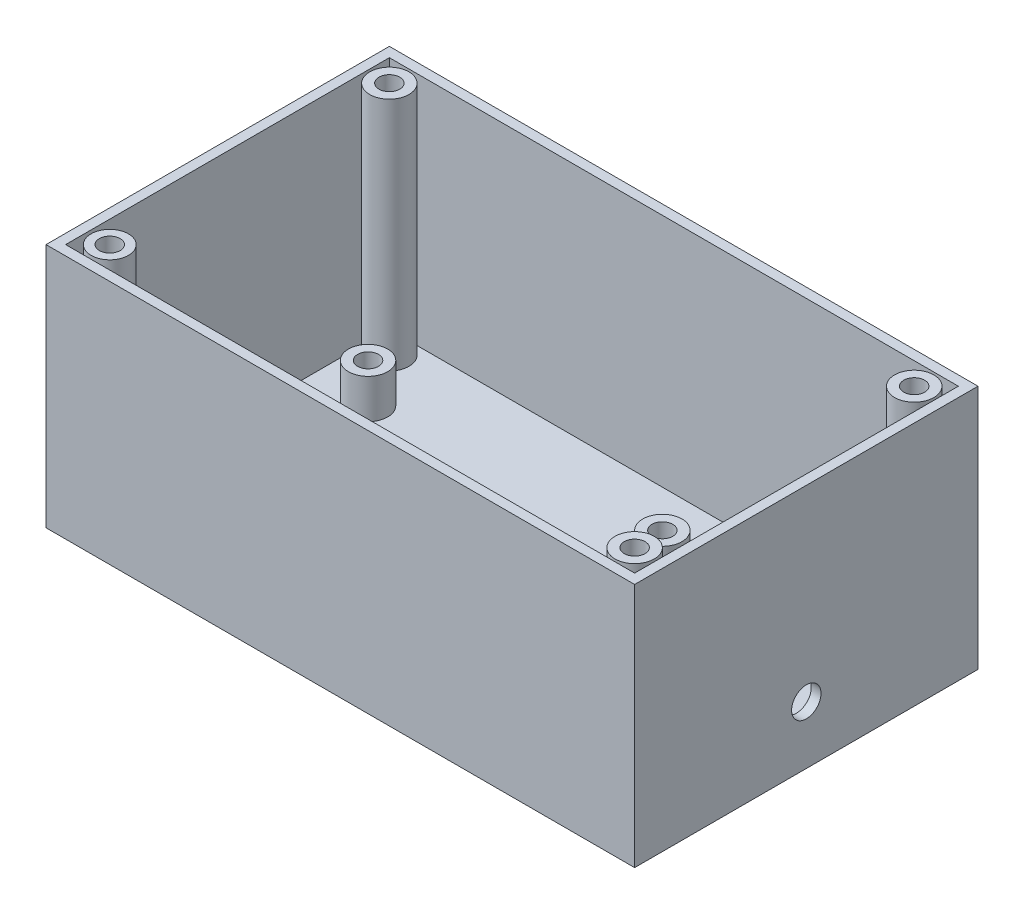
from build123d import *

# Parameters (mm, degrees)
SKETCH1_W           = 120
SKETCH1_H           = 70
BOSS_EXTRUDE1_DEPTH = 50
SKETCH4_W           = 116
SKETCH4_H           = 66
CUT_EXTRUDE1_DEPTH  = 48
SKETCH5_R           = 4
SKETCH5_R_2         = 2.125
SKETCH5_R_3         = 3.805710372
BOSS_EXTRUDE2_DEPTH = 48
SKETCH7_R           = 4
SKETCH7_R_2         = 2.125
BOSS_EXTRUDE3_DEPTH = 8
SKETCH9_R           = 3
CUT_EXTRUDE2_DEPTH  = 3
CUT_EXTRUDE3_START  = -3
SKETCH10_R          = 3
CUT_EXTRUDE3_DEPTH  = 3


with BuildPart() as part:
    # Sketch1 → Boss-Extrude1 (new body)
    with BuildSketch(Plane(origin=(0, 0, 0), x_dir=(1, 0, 0), z_dir=(0, 1, 0))):
        Rectangle(SKETCH1_W, SKETCH1_H)
    extrude(amount=BOSS_EXTRUDE1_DEPTH)

    # Sketch4 → Cut-Extrude1 (cut)
    with BuildSketch(Plane(origin=(0, 50, 0), x_dir=(1, 0, 0), z_dir=(0, 1, 0))):
        Rectangle(SKETCH4_W, SKETCH4_H)
    extrude(amount=-CUT_EXTRUDE1_DEPTH, mode=Mode.SUBTRACT)

    # Sketch5 → Boss-Extrude2 (add)
    # profile 1 of 4: a face of its own
    with BuildSketch(Plane(origin=(0, 2, 0), x_dir=(1, 0, 0), z_dir=(0, 1, 0))):
        with Locations(Location((-53.5, 28.5, 0), (0, 0, 270))):
            Circle(SKETCH5_R)
        with Locations(Location((-53.5, 28.5, 0), (0, 0, 270))):
            Circle(SKETCH5_R_2, mode=Mode.SUBTRACT)
    # profile 2 of 4: a face of its own
    with BuildSketch(Plane(origin=(0, 2, 0), x_dir=(1, 0, 0), z_dir=(0, 1, 0))):
        with Locations(Location((-53.5, -28.5, 0), (0, 0, 270))):
            Circle(SKETCH5_R_3)
        with Locations(Location((-53.5, -28.5, 0), (0, 0, 270))):
            Circle(SKETCH5_R_2, mode=Mode.SUBTRACT)
    # profile 3 of 4: a face of its own
    with BuildSketch(Plane(origin=(0, 2, 0), x_dir=(1, 0, 0), z_dir=(0, 1, 0))):
        with Locations(Location((53.5, -28.5, 0), (0, 0, 270))):
            Circle(SKETCH5_R)
        with Locations(Location((53.5, -28.5, 0), (0, 0, 270))):
            Circle(SKETCH5_R_2, mode=Mode.SUBTRACT)
    # profile 4 of 4: a face of its own
    with BuildSketch(Plane(origin=(0, 2, 0), x_dir=(1, 0, 0), z_dir=(0, 1, 0))):
        with Locations(Location((53.5, 28.5, 0), (0, 0, 270))):
            Circle(SKETCH5_R)
        with Locations(Location((53.5, 28.5, 0), (0, 0, 270))):
            Circle(SKETCH5_R_2, mode=Mode.SUBTRACT)
    extrude(amount=BOSS_EXTRUDE2_DEPTH)

    # Sketch7 → Boss-Extrude3 (add)
    # profile 1 of 8: a face of its own
    with BuildSketch(Plane(origin=(0, 2, 0), x_dir=(1, 0, 0), z_dir=(0, 1, 0))):
        with Locations(Location((41.989163704, 23.984280939, 0), (0, 0, 270))):
            Circle(SKETCH7_R)
        with Locations(Location((41.989163704, 23.984280939, 0), (0, 0, 270))):
            Circle(SKETCH7_R_2, mode=Mode.SUBTRACT)
    # profile 2 of 8: a face of its own
    with BuildSketch(Plane(origin=(0, 2, 0), x_dir=(1, 0, 0), z_dir=(0, 1, 0))):
        with Locations(Location((27.989163704, 23.984280939, 0), (0, 0, 270))):
            Circle(SKETCH7_R)
        with Locations(Location((27.989163704, 23.984280939, 0), (0, 0, 270))):
            Circle(SKETCH7_R_2, mode=Mode.SUBTRACT)
    # profile 3 of 8: a face of its own
    with BuildSketch(Plane(origin=(0, 2, 0), x_dir=(1, 0, 0), z_dir=(0, 1, 0))):
        with Locations(Location((27.989163704, -25.015719061, 0), (0, 0, 270))):
            Circle(SKETCH7_R)
        with Locations(Location((27.989163704, -25.015719061, 0), (0, 0, 270))):
            Circle(SKETCH7_R_2, mode=Mode.SUBTRACT)
    # profile 4 of 8: a face of its own
    with BuildSketch(Plane(origin=(0, 2, 0), x_dir=(1, 0, 0), z_dir=(0, 1, 0))):
        with Locations(Location((41.989163704, -25.015719061, 0), (0, 0, 270))):
            Circle(SKETCH7_R)
        with Locations(Location((41.989163704, -25.015719061, 0), (0, 0, 270))):
            Circle(SKETCH7_R_2, mode=Mode.SUBTRACT)
    # profile 5 of 8: a face of its own
    with BuildSketch(Plane(origin=(0, 2, 0), x_dir=(1, 0, 0), z_dir=(0, 1, 0))):
        with Locations(Location((13.265207025, -17.861812849, 0), (0, 0, 270))):
            Circle(SKETCH7_R)
        with Locations(Location((13.265207025, -17.861812849, 0), (0, 0, 270))):
            Circle(SKETCH7_R_2, mode=Mode.SUBTRACT)
    # profile 6 of 8: a face of its own
    with BuildSketch(Plane(origin=(0, 2, 0), x_dir=(1, 0, 0), z_dir=(0, 1, 0))):
        with Locations(Location((13.265207025, 17.388187151, 0), (0, 0, 270))):
            Circle(SKETCH7_R)
        with Locations(Location((13.265207025, 17.388187151, 0), (0, 0, 270))):
            Circle(SKETCH7_R_2, mode=Mode.SUBTRACT)
    # profile 7 of 8: a face of its own
    with BuildSketch(Plane(origin=(0, 2, 0), x_dir=(1, 0, 0), z_dir=(0, 1, 0))):
        with Locations(Location((-46.734792975, 17.388187151, 0), (0, 0, 270))):
            Circle(SKETCH7_R)
        with Locations(Location((-46.734792975, 17.388187151, 0), (0, 0, 270))):
            Circle(SKETCH7_R_2, mode=Mode.SUBTRACT)
    # profile 8 of 8: a face of its own
    with BuildSketch(Plane(origin=(0, 2, 0), x_dir=(1, 0, 0), z_dir=(0, 1, 0))):
        with Locations(Location((-46.734792975, -17.861812849, 0), (0, 0, 270))):
            Circle(SKETCH7_R)
        with Locations(Location((-46.734792975, -17.861812849, 0), (0, 0, 270))):
            Circle(SKETCH7_R_2, mode=Mode.SUBTRACT)
    extrude(amount=BOSS_EXTRUDE3_DEPTH)

    # Sketch9 → Cut-Extrude2 (cut)
    with BuildSketch(Plane(origin=(60, 0, 0), x_dir=(0, 0, -1), z_dir=(1, 0, 0))):
        with Locations((0, 11.776029547)):
            Circle(SKETCH9_R)
    extrude(amount=-CUT_EXTRUDE2_DEPTH, mode=Mode.SUBTRACT)

    # Sketch10 → Cut-Extrude3 (cut)
    with BuildSketch(Plane.ZY.offset(60).offset(CUT_EXTRUDE3_START)):
        with Locations(Location((0, 11.776029547, 0), (0, 0, 180))):
            Circle(SKETCH10_R)
    extrude(amount=CUT_EXTRUDE3_DEPTH, mode=Mode.SUBTRACT)


solid = part.part
